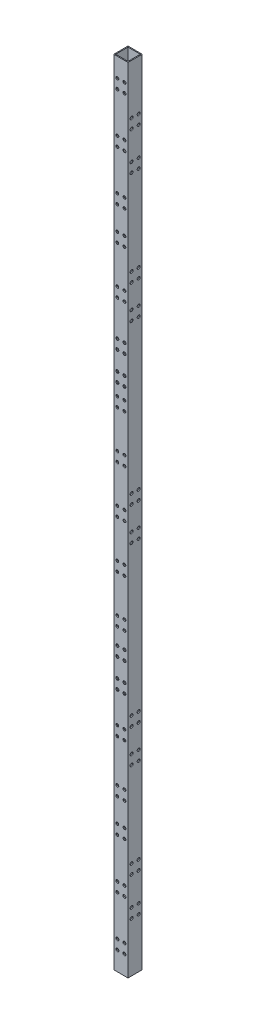
from build123d import *

# Parameters (mm, degrees)
SKETCH_1_W          = 15
SKETCH_1_H          = 15
SKETCH_1_W_2        = 13
SKETCH_1_H_2        = 13
EXTRUDE_1_DEPTH     = 835
SKETCH_2_R          = 1.575
SKETCH_2_R_2        = 1.6
SKETCH_2_R_3        = 1.51
CUT_EXTRUDE_1_DEPTH = 15
SKETCH_3_R          = 1.6
CUT_EXTRUDE_2_DEPTH = 15


with BuildPart() as part:
    # 草图1 → 凸台-拉伸1 (new body)
    with BuildSketch(Plane(origin=(0, 0, 0), x_dir=(1, 0, 0), z_dir=(0, 1, 0))):
        Rectangle(SKETCH_1_W, SKETCH_1_H)
        Rectangle(SKETCH_1_W_2, SKETCH_1_H_2, mode=Mode.SUBTRACT)
    extrude(amount=EXTRUDE_1_DEPTH)

    # 草图2 → 切除-拉伸1 (cut)
    with BuildSketch(Plane.XY.offset(7.5)):
        with Locations((-3.75, 762.5)):
            Circle(SKETCH_2_R)
        with Locations((3.75, 762.5)):
            Circle(SKETCH_2_R)
        with Locations((-3.75, 752.5)):
            Circle(SKETCH_2_R)
        with Locations((3.75, 752.5)):
            Circle(SKETCH_2_R)
        with Locations((3.75, 82.5)):
            Circle(SKETCH_2_R)
        with Locations((-3.75, 82.5)):
            Circle(SKETCH_2_R)
        with Locations((3.75, 72.5)):
            Circle(SKETCH_2_R)
        with Locations((-3.75, 72.5)):
            Circle(SKETCH_2_R)
        with Locations((-3.75, 815)):
            Circle(SKETCH_2_R_2)
        with Locations((3.75, 815)):
            Circle(SKETCH_2_R_2)
        with Locations((3.75, 805)):
            Circle(SKETCH_2_R_2)
        with Locations((-3.75, 805)):
            Circle(SKETCH_2_R_2)
        with Locations((-3.75, 30)):
            Circle(SKETCH_2_R_2)
        with Locations((3.75, 30)):
            Circle(SKETCH_2_R_2)
        with Locations((3.75, 20)):
            Circle(SKETCH_2_R_2)
        with Locations((-3.75, 20)):
            Circle(SKETCH_2_R_2)
        with Locations((-3.75, 710)):
            Circle(SKETCH_2_R_3)
        with Locations((3.75, 710)):
            Circle(SKETCH_2_R_3)
        with Locations((3.75, 700)):
            Circle(SKETCH_2_R_3)
        with Locations((-3.75, 700)):
            Circle(SKETCH_2_R_3)
        with Locations((-3.75, 675)):
            Circle(SKETCH_2_R_3)
        with Locations((3.75, 675)):
            Circle(SKETCH_2_R_3)
        with Locations((3.75, 665)):
            Circle(SKETCH_2_R_3)
        with Locations((-3.75, 665)):
            Circle(SKETCH_2_R_3)
        with Locations((-3.75, 170)):
            Circle(SKETCH_2_R_3)
        with Locations((3.75, 170)):
            Circle(SKETCH_2_R_3)
        with Locations((3.75, 160)):
            Circle(SKETCH_2_R_3)
        with Locations((-3.75, 160)):
            Circle(SKETCH_2_R_3)
        with Locations((-3.75, 135)):
            Circle(SKETCH_2_R_3)
        with Locations((3.75, 135)):
            Circle(SKETCH_2_R_3)
        with Locations((3.75, 125)):
            Circle(SKETCH_2_R_3)
        with Locations((-3.75, 125)):
            Circle(SKETCH_2_R_3)
        with Locations((-3.75, 625)):
            Circle(SKETCH_2_R_3)
        with Locations((3.75, 615)):
            Circle(SKETCH_2_R_3)
        with Locations((3.75, 625)):
            Circle(SKETCH_2_R_3)
        with Locations((-3.75, 615)):
            Circle(SKETCH_2_R_3)
        with Locations((-3.75, 525)):
            Circle(SKETCH_2_R_3)
        with Locations((3.75, 515)):
            Circle(SKETCH_2_R_3)
        with Locations((3.75, 525)):
            Circle(SKETCH_2_R_3)
        with Locations((-3.75, 515)):
            Circle(SKETCH_2_R_3)
        with Locations((-3.75, 475)):
            Circle(SKETCH_2_R_3)
        with Locations((3.75, 465)):
            Circle(SKETCH_2_R_3)
        with Locations((3.75, 475)):
            Circle(SKETCH_2_R_3)
        with Locations((-3.75, 465)):
            Circle(SKETCH_2_R_3)
        with Locations((-3.75, 425)):
            Circle(SKETCH_2_R_3)
        with Locations((3.75, 415)):
            Circle(SKETCH_2_R_3)
        with Locations((3.75, 425)):
            Circle(SKETCH_2_R_3)
        with Locations((-3.75, 415)):
            Circle(SKETCH_2_R_3)
        with Locations((-3.75, 375)):
            Circle(SKETCH_2_R_3)
        with Locations((3.75, 365)):
            Circle(SKETCH_2_R_3)
        with Locations((3.75, 375)):
            Circle(SKETCH_2_R_3)
        with Locations((-3.75, 365)):
            Circle(SKETCH_2_R_3)
        with Locations((-3.75, 325)):
            Circle(SKETCH_2_R_3)
        with Locations((3.75, 315)):
            Circle(SKETCH_2_R_3)
        with Locations((3.75, 325)):
            Circle(SKETCH_2_R_3)
        with Locations((-3.75, 315)):
            Circle(SKETCH_2_R_3)
        with Locations((-3.75, 225)):
            Circle(SKETCH_2_R_3)
        with Locations((3.75, 215)):
            Circle(SKETCH_2_R_3)
        with Locations((3.75, 225)):
            Circle(SKETCH_2_R_3)
        with Locations((-3.75, 215)):
            Circle(SKETCH_2_R_3)
        with Locations((-3.75, 567.5)):
            Circle(SKETCH_2_R_2)
        with Locations((3.75, 567.5)):
            Circle(SKETCH_2_R_2)
        with Locations((3.75, 577.5)):
            Circle(SKETCH_2_R_2)
        with Locations((-3.75, 577.5)):
            Circle(SKETCH_2_R_2)
        with Locations((-3.75, 537.5)):
            Circle(SKETCH_2_R_2)
        with Locations((3.75, 537.5)):
            Circle(SKETCH_2_R_2)
        with Locations((3.75, 547.5)):
            Circle(SKETCH_2_R_2)
        with Locations((-3.75, 547.5)):
            Circle(SKETCH_2_R_2)
        with Locations((-3.75, 287.5)):
            Circle(SKETCH_2_R_2)
        with Locations((3.75, 287.5)):
            Circle(SKETCH_2_R_2)
        with Locations((3.75, 297.5)):
            Circle(SKETCH_2_R_2)
        with Locations((-3.75, 297.5)):
            Circle(SKETCH_2_R_2)
        with Locations((-3.75, 257.5)):
            Circle(SKETCH_2_R_2)
        with Locations((3.75, 257.5)):
            Circle(SKETCH_2_R_2)
        with Locations((3.75, 267.5)):
            Circle(SKETCH_2_R_2)
        with Locations((-3.75, 267.5)):
            Circle(SKETCH_2_R_2)
    extrude(amount=-CUT_EXTRUDE_1_DEPTH, mode=Mode.SUBTRACT)

    # 草图3 → 切除-拉伸2 (cut)
    with BuildSketch(Plane.ZY.offset(7.5)):
        with Locations((-3.75, 782.5)):
            Circle(SKETCH_3_R)
        with Locations((3.75, 782.5)):
            Circle(SKETCH_3_R)
        with Locations((-3.75, 772.5)):
            Circle(SKETCH_3_R)
        with Locations((3.75, 772.5)):
            Circle(SKETCH_3_R)
        with Locations((3.75, 742.5)):
            Circle(SKETCH_3_R)
        with Locations((-3.75, 742.5)):
            Circle(SKETCH_3_R)
        with Locations((3.75, 732.5)):
            Circle(SKETCH_3_R)
        with Locations((-3.75, 732.5)):
            Circle(SKETCH_3_R)
        with Locations((-3.75, 102.5)):
            Circle(SKETCH_3_R)
        with Locations((3.75, 102.5)):
            Circle(SKETCH_3_R)
        with Locations((-3.75, 92.5)):
            Circle(SKETCH_3_R)
        with Locations((3.75, 92.5)):
            Circle(SKETCH_3_R)
        with Locations((3.75, 62.5)):
            Circle(SKETCH_3_R)
        with Locations((-3.75, 62.5)):
            Circle(SKETCH_3_R)
        with Locations((3.75, 52.5)):
            Circle(SKETCH_3_R)
        with Locations((-3.75, 52.5)):
            Circle(SKETCH_3_R)
        with Locations((-3.75, 642.5)):
            Circle(SKETCH_3_R)
        with Locations((3.75, 642.5)):
            Circle(SKETCH_3_R)
        with Locations((3.75, 632.5)):
            Circle(SKETCH_3_R)
        with Locations((-3.75, 632.5)):
            Circle(SKETCH_3_R)
        with Locations((-3.75, 607.5)):
            Circle(SKETCH_3_R)
        with Locations((3.75, 607.5)):
            Circle(SKETCH_3_R)
        with Locations((3.75, 597.5)):
            Circle(SKETCH_3_R)
        with Locations((-3.75, 597.5)):
            Circle(SKETCH_3_R)
        with Locations((-3.75, 237.5)):
            Circle(SKETCH_3_R)
        with Locations((3.75, 237.5)):
            Circle(SKETCH_3_R)
        with Locations((3.75, 227.5)):
            Circle(SKETCH_3_R)
        with Locations((-3.75, 227.5)):
            Circle(SKETCH_3_R)
        with Locations((-3.75, 202.5)):
            Circle(SKETCH_3_R)
        with Locations((3.75, 202.5)):
            Circle(SKETCH_3_R)
        with Locations((3.75, 192.5)):
            Circle(SKETCH_3_R)
        with Locations((-3.75, 192.5)):
            Circle(SKETCH_3_R)
        with Locations((-3.75, 440)):
            Circle(SKETCH_3_R)
        with Locations((3.75, 440)):
            Circle(SKETCH_3_R)
        with Locations((3.75, 430)):
            Circle(SKETCH_3_R)
        with Locations((-3.75, 430)):
            Circle(SKETCH_3_R)
        with Locations((-3.75, 405)):
            Circle(SKETCH_3_R)
        with Locations((3.75, 405)):
            Circle(SKETCH_3_R)
        with Locations((3.75, 395)):
            Circle(SKETCH_3_R)
        with Locations((-3.75, 395)):
            Circle(SKETCH_3_R)
    extrude(amount=-CUT_EXTRUDE_2_DEPTH, mode=Mode.SUBTRACT)


solid = part.part
